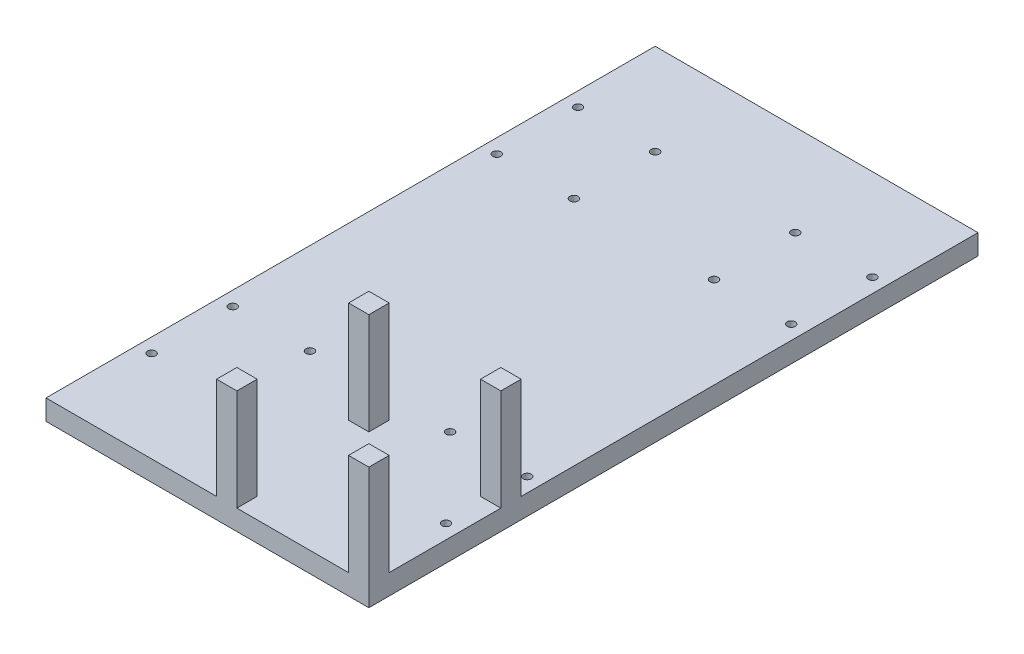
from build123d import *

# Parameters (mm, degrees)
SKETCH3_W           = 159
SKETCH3_H           = 300
BOSS_EXTRUDE1_DEPTH = 10
SKETCH4_W           = 10
SKETCH4_H           = 10
BOSS_EXTRUDE2_DEPTH = 50
SKETCH7_R           = 2
SKETCH7_R_2         = 2.000000006
SKETCH7_R_3         = 1.999999994
CUT_EXTRUDE2_DEPTH  = 10


with BuildPart() as part:
    # Sketch3 → Boss-Extrude1 (new body)
    with BuildSketch(Plane(origin=(0, 0, 0), x_dir=(1, 0, 0), z_dir=(0, 1, 0))):
        Rectangle(SKETCH3_W, SKETCH3_H)
    extrude(amount=BOSS_EXTRUDE1_DEPTH)

    # Sketch4 → Boss-Extrude2 (add)
    with BuildSketch(Plane(origin=(0, 10, 0), x_dir=(1, 0, 0), z_dir=(0, 1, 0))):
        with Locations((74.5, -145)):
            Rectangle(SKETCH4_W, SKETCH4_H)
        with Locations((74.5, -80)):
            Rectangle(SKETCH4_W, SKETCH4_H)
        with Locations((9.5, -145)):
            Rectangle(SKETCH4_W, SKETCH4_H)
        with Locations((9.5, -80)):
            Rectangle(SKETCH4_W, SKETCH4_H)
    extrude(amount=BOSS_EXTRUDE2_DEPTH)

    # Sketch7 → Cut-Extrude2 (cut)
    with BuildSketch(Plane.XZ):
        with Locations(Location((34.5, -105, 0), (0, 0, 270))):
            Circle(SKETCH7_R)
        with Locations(Location((72.5, -105, 0), (0, 0, 270))):
            Circle(SKETCH7_R)
        with Locations(Location((72.5, -65, 0), (0, 0, 270))):
            Circle(SKETCH7_R)
        with Locations(Location((34.5, -65, 0), (0, 0, 270))):
            Circle(SKETCH7_R)
        with Locations(Location((-34.5, -65, 0), (0, 0, 270))):
            Circle(SKETCH7_R)
        with Locations(Location((-72.5, -65, 0), (0, 0, 270))):
            Circle(SKETCH7_R)
        with Locations(Location((-34.5, -105, 0), (0, 0, 270))):
            Circle(SKETCH7_R)
        with Locations(Location((-72.5, -105, 0), (0, 0, 270))):
            Circle(SKETCH7_R)
        with Locations(Location((-72.5, 65, 0), (0, 0, 270))):
            Circle(SKETCH7_R)
        with Locations(Location((-72.5, 105, 0), (0, 0, 270))):
            Circle(SKETCH7_R)
        with Locations(Location((-34.5, 105, 0), (0, 0, 270))):
            Circle(SKETCH7_R_2)
        with Locations(Location((-34.5, 65, 0), (0, 0, 270))):
            Circle(SKETCH7_R)
        with Locations(Location((34.5, 105, 0), (0, 0, 270))):
            Circle(SKETCH7_R_3)
        with Locations(Location((72.5, 105, 0), (0, 0, 270))):
            Circle(SKETCH7_R)
        with Locations(Location((72.5, 65, 0), (0, 0, 270))):
            Circle(SKETCH7_R)
        with Locations(Location((34.5, 65, 0), (0, 0, 270))):
            Circle(SKETCH7_R)
    extrude(amount=-CUT_EXTRUDE2_DEPTH, mode=Mode.SUBTRACT)


solid = part.part
